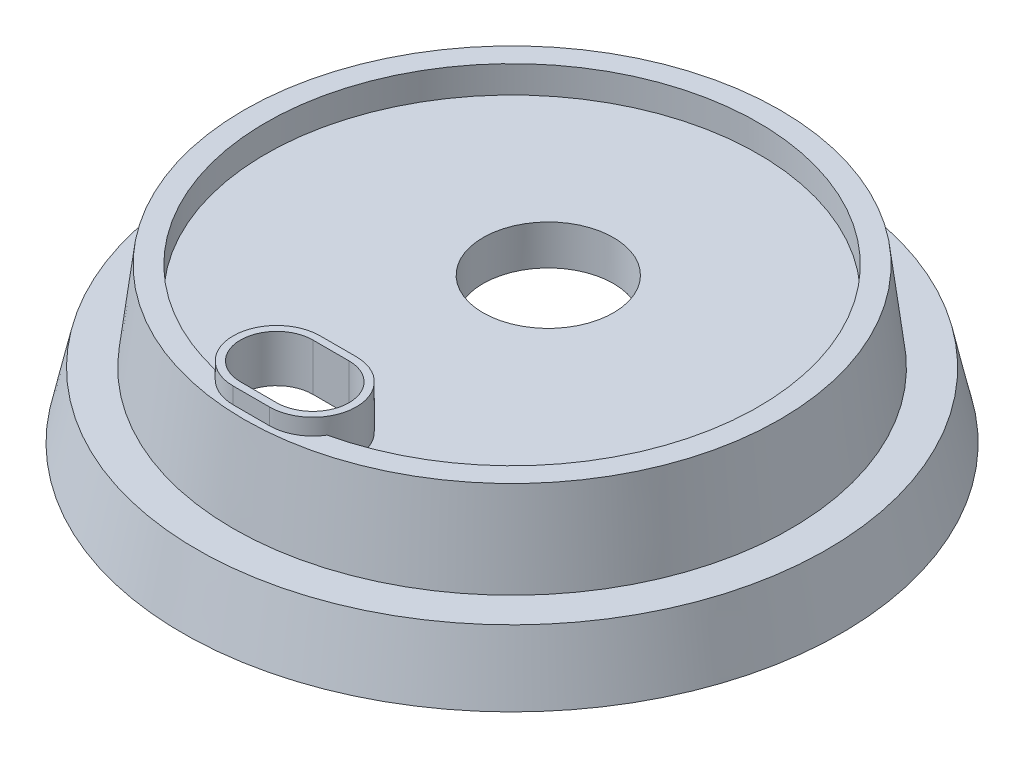
from build123d import *

# Parameters (mm, degrees)
CUT_EXTRUDE_1_DEPTH = 5
EXTRUDE_START       = 6
EXTRUDE_1_DEPTH     = 6
SKETCH_8_R          = 9
CUT_EXTRUDE_2_DEPTH = 6
SKETCH_9_R          = 10
SKETCH_9_R_2        = 9
EXTRUDE_2_DEPTH     = 5


with BuildPart() as part:
    # 草图2 → 旋转1 (revolve)
    with BuildSketch(Plane.XY, mode=Mode.PRIVATE) as revolve_1_sk:
        Polygon((43.5, 0), (45.5, -9), (45.01190647, -9.108465229), (43.098914197, -0.5), (38.057271307, -0.5), (36.557271307, 11.8), (34.5, 11.8), (34.5, 8.05), (0, 8.05), (0, 8.55), (34, 8.55), (34, 12.3), (37, 12.3), (38.5, 0), align=None)
    revolve(revolve_1_sk.sketch.rotate(Axis((0, 0, 0), (0, 1, 0)), 90), axis=Axis((0, 0, 0), (0, 1, 0)))

    # 草图4 → 切除-拉伸1 (cut, symmetric)
    with BuildSketch(Plane(origin=(0, 8.55, 0), x_dir=(1, 0, 0), z_dir=(0, 1, 0))):
        with BuildLine():
            Line((-2.5, -35), (2.5, -35))
            ThreePointArc((2.5, -35), (7.5, -30), (2.5, -25))
            Line((2.5, -25), (-2.5, -25))
            ThreePointArc((-2.5, -25), (-7.5, -30), (-2.5, -35))
        make_face()
    extrude(amount=CUT_EXTRUDE_1_DEPTH, both=True, mode=Mode.SUBTRACT)

    # 草图6 → 凸台-拉伸1 (add)
    with BuildSketch(Plane(origin=(0, 8.55, 0), x_dir=(1, 0, 0), z_dir=(0, 1, 0)).offset(EXTRUDE_START)):
        with BuildLine():
            Line((-2.5, -24), (2.5, -24))
            ThreePointArc((2.5, -24), (8.5, -30), (2.5, -36))
            Line((2.5, -36), (-2.5, -36))
            ThreePointArc((-2.5, -36), (-8.5, -30), (-2.5, -24))
        make_face()
        with BuildLine():
            Line((-2.5, -25), (2.5, -25))
            ThreePointArc((2.5, -25), (7.5, -30), (2.5, -35))
            Line((2.5, -35), (-2.5, -35))
            ThreePointArc((-2.5, -35), (-7.5, -30), (-2.5, -25))
        make_face(mode=Mode.SUBTRACT)
    extrude(amount=-EXTRUDE_1_DEPTH)

    # 草图8 → 切除-拉伸2 (cut)
    with BuildSketch(Plane(origin=(0, 8.55, 0), x_dir=(1, 0, 0), z_dir=(0, 1, 0))):
        with Locations(Location((0, 5, 0), (0, 0, 270))):
            Circle(SKETCH_8_R)
    extrude(amount=-CUT_EXTRUDE_2_DEPTH, mode=Mode.SUBTRACT)

    # 草图9 → 凸台-拉伸2 (add)
    with BuildSketch(Plane.XZ.offset(-8.05)):
        with Locations(Location((0, -5, 0), (0, 0, 270))):
            Circle(SKETCH_9_R)
        with Locations(Location((0, -5, 0), (0, 0, 90))):
            Circle(SKETCH_9_R_2, mode=Mode.SUBTRACT)
    extrude(amount=EXTRUDE_2_DEPTH)


solid = part.part
